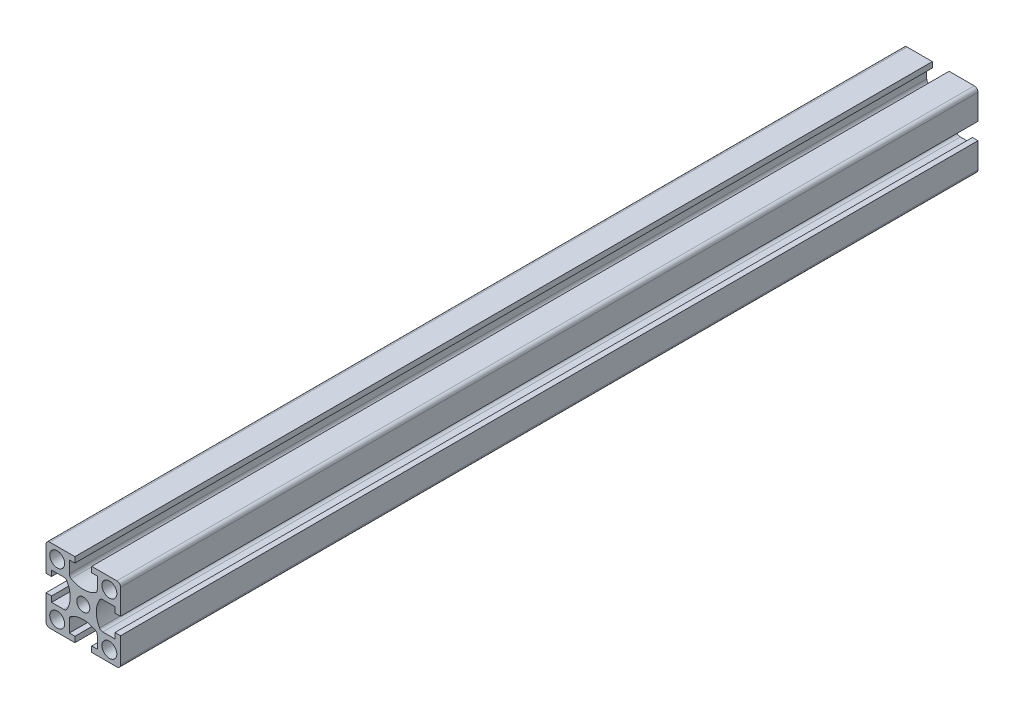
from build123d import *

# Parameters (mm, degrees)
SKETCH1_R           = 4
SKETCH1_R_2         = 3.5
BOSS_EXTRUDE1_DEPTH = 460


with BuildPart() as part:
    # Sketch1 → Boss-Extrude1 (new body)
    with BuildSketch(Plane.XY):
        with BuildLine():
            Line((-20, 18), (-20, 4.5))
            Line((-20, 4.5), (-17, 4.5))
            Line((-17, 4.5), (-17, 7.5))
            Line((-17, 7.5), (-10.473720558, 7.5))
            ThreePointArc((-10.473720558, 7.5), (-9.473720558, 7.232050808), (-8.741669751, 6.5))
            ThreePointArc((-8.741669751, 6.5), (-7, 0), (-8.741669751, -6.5))
            ThreePointArc((-8.741669751, -6.5), (-9.473720558, -7.232050808), (-10.473720558, -7.5))
            Line((-10.473720558, -7.5), (-17, -7.5))
            Line((-17, -7.5), (-17, -4.5))
            Line((-17, -4.5), (-20, -4.5))
            Line((-20, -4.5), (-20, -18))
            ThreePointArc((-20, -18), (-19.414213562, -19.414213562), (-18, -20))
            Line((-18, -20), (-4.5, -20))
            Line((-4.5, -20), (-4.5, -17))
            Line((-4.5, -17), (-7.5, -17))
            Line((-7.5, -17), (-7.5, -10.473720558))
            ThreePointArc((-7.5, -10.473720558), (-7.232050808, -9.473720558), (-6.5, -8.741669751))
            ThreePointArc((-6.5, -8.741669751), (0, -7), (6.5, -8.741669751))
            ThreePointArc((6.5, -8.741669751), (7.232050808, -9.473720558), (7.5, -10.473720558))
            Line((7.5, -10.473720558), (7.5, -17))
            Line((7.5, -17), (4.5, -17))
            Line((4.5, -17), (4.5, -20))
            Line((4.5, -20), (18, -20))
            ThreePointArc((18, -20), (19.414213562, -19.414213562), (20, -18))
            Line((20, -18), (20, -4.5))
            Line((20, -4.5), (17, -4.5))
            Line((17, -4.5), (17, -7.5))
            Line((17, -7.5), (10.473720558, -7.5))
            ThreePointArc((10.473720558, -7.5), (9.473720558, -7.232050808), (8.741669751, -6.5))
            ThreePointArc((8.741669751, -6.5), (7, 0), (8.741669751, 6.5))
            ThreePointArc((8.741669751, 6.5), (9.473720558, 7.232050808), (10.473720558, 7.5))
            Line((10.473720558, 7.5), (17, 7.5))
            Line((17, 7.5), (17, 4.5))
            Line((17, 4.5), (20, 4.5))
            Line((20, 4.5), (20, 18))
            ThreePointArc((20, 18), (19.414213562, 19.414213562), (18, 20))
            Line((18, 20), (4.5, 20))
            Line((4.5, 20), (4.5, 17))
            Line((4.5, 17), (7.5, 17))
            Line((7.5, 17), (7.5, 10.473720558))
            ThreePointArc((7.5, 10.473720558), (7.232050808, 9.473720558), (6.5, 8.741669751))
            ThreePointArc((6.5, 8.741669751), (0, 7), (-6.5, 8.741669751))
            ThreePointArc((-6.5, 8.741669751), (-7.232050808, 9.473720558), (-7.5, 10.473720558))
            Line((-7.5, 10.473720558), (-7.5, 17))
            Line((-7.5, 17), (-4.5, 17))
            Line((-4.5, 17), (-4.5, 20))
            Line((-4.5, 20), (-18, 20))
            ThreePointArc((-18, 20), (-19.414213562, 19.414213562), (-20, 18))
        make_face()
        with Locations((-14, -14)):
            Circle(SKETCH1_R, mode=Mode.SUBTRACT)
        with Locations((14, -14)):
            Circle(SKETCH1_R, mode=Mode.SUBTRACT)
        with Locations((14, 14)):
            Circle(SKETCH1_R, mode=Mode.SUBTRACT)
        Circle(SKETCH1_R_2, mode=Mode.SUBTRACT)
        with Locations((-14, 14)):
            Circle(SKETCH1_R, mode=Mode.SUBTRACT)
    extrude(amount=BOSS_EXTRUDE1_DEPTH)


solid = part.part
